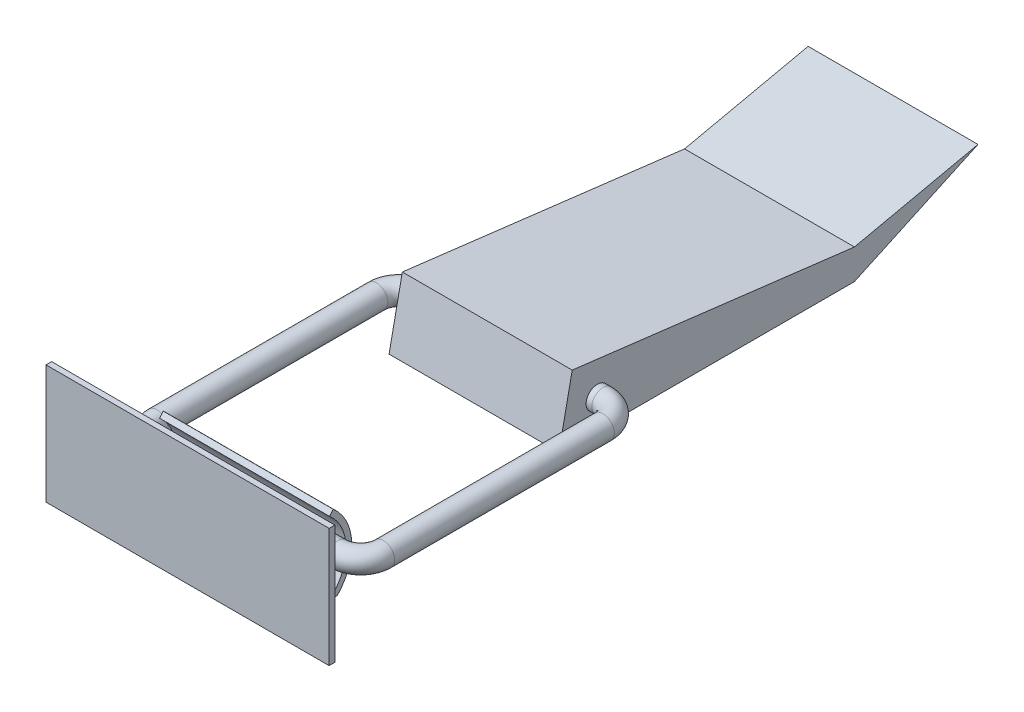
from build123d import *

# Parameters (mm, degrees)
BOSS_EXTRUDE1_DEPTH      = 15
SWEEP1_PROFILE_R         = 1
BOSS_EXTRUDE2_DEPTH      = 7.5
BOSS_EXTRUDE3_DEPTH      = 5
BOSS_EXTRUDE3_DEPTH_BACK = 20
SKETCH14_W               = 0.5
SKETCH14_H               = 10.5


with BuildPart() as part:
    # Sketch1 → Boss-Extrude1 (new body)
    with BuildSketch(Plane(origin=(0, 0, 0), x_dir=(0, 0, -1), z_dir=(1, 0, 0))):
        Polygon((0, 0), (1.171850901, 5.696384018), (26.090909091, 2.649743604), (37, 5.036278595), (26.090909091, 0), align=None)
    extrude(amount=BOSS_EXTRUDE1_DEPTH)

    # Sweep1: sweep along a path in Sketch2
    with BuildLine(Plane(origin=(0, 2.5, 0), x_dir=(-1, 0, 0), z_dir=(0, -1, 0))) as sweep1_path:
        Line((-15, 3.39620624), (-15.5, 3.39620624))
        ThreePointArc((-15.5, 3.39620624), (-16.914213562, 2.810419803), (-17.5, 1.39620624))
        Line((-17.5, 1.39620624), (-17.5, -18))
        ThreePointArc((-17.5, -18), (-16.914213562, -19.414213562), (-15.5, -20))
        Line((-15.5, -20), (0.5, -20))
        ThreePointArc((0.5, -20), (1.914213562, -19.414213562), (2.5, -18))
        Line((2.5, -18), (2.5, 1.39620624))
        ThreePointArc((2.5, 1.39620624), (1.914213562, 2.810419803), (0.5, 3.39620624))
        Line((0.5, 3.39620624), (0, 3.39620624))
    # Sweep1 profile (on start of the path) → Sweep1 (sweep)
    with BuildSketch(Plane(origin=(15, 2.5, -3.39620624), x_dir=(0, 0, 1), z_dir=(1, 0, 0))):
        Circle(SWEEP1_PROFILE_R)
    sweep(path=sweep1_path.line)


with BuildPart() as body_2:
    # Sketch13 → Boss-Extrude2 (new, symmetric)
    with BuildSketch(Plane(origin=(7.5, 0, 0), x_dir=(0, 0, -1), z_dir=(1, 0, 0))):
        with BuildLine():
            Line((-19.790552216, -0.674159606), (-24.790552216, -0.674159606))
            Line((-24.790552216, -0.674159606), (-24.790552216, 9.325840394))
            Line((-24.790552216, 9.325840394), (-25.290552216, 9.325840394))
            Line((-25.290552216, 9.325840394), (-25.290552216, -1.174159606))
            Line((-25.290552216, -1.174159606), (-19.567594031, -1.174159606))
            ThreePointArc((-19.567594031, -1.174159606), (-18.296290964, 2.297128651), (-19.935793988, 5.610447755))
            Line((-19.935793988, 5.610447755), (-20.260199098, 5.229972625))
            ThreePointArc((-20.260199098, 5.229972625), (-18.802589835, 2.375173563), (-19.790552216, -0.674159606))
        make_face()
    extrude(amount=BOSS_EXTRUDE2_DEPTH, both=True)

    # Sketch14 → Boss-Extrude3 (add, two sides: drawn at the far end of the back side and taken through both)
    with BuildSketch(Plane(origin=(15, 0, 0), x_dir=(0, 0, -1), z_dir=(1, 0, 0)).offset(-BOSS_EXTRUDE3_DEPTH_BACK)):
        with Locations((-25.040552216, 4.075840394)):
            Rectangle(SKETCH14_W, SKETCH14_H)
    extrude(amount=BOSS_EXTRUDE3_DEPTH + BOSS_EXTRUDE3_DEPTH_BACK)


solid = Compound([part.part, body_2.part])
